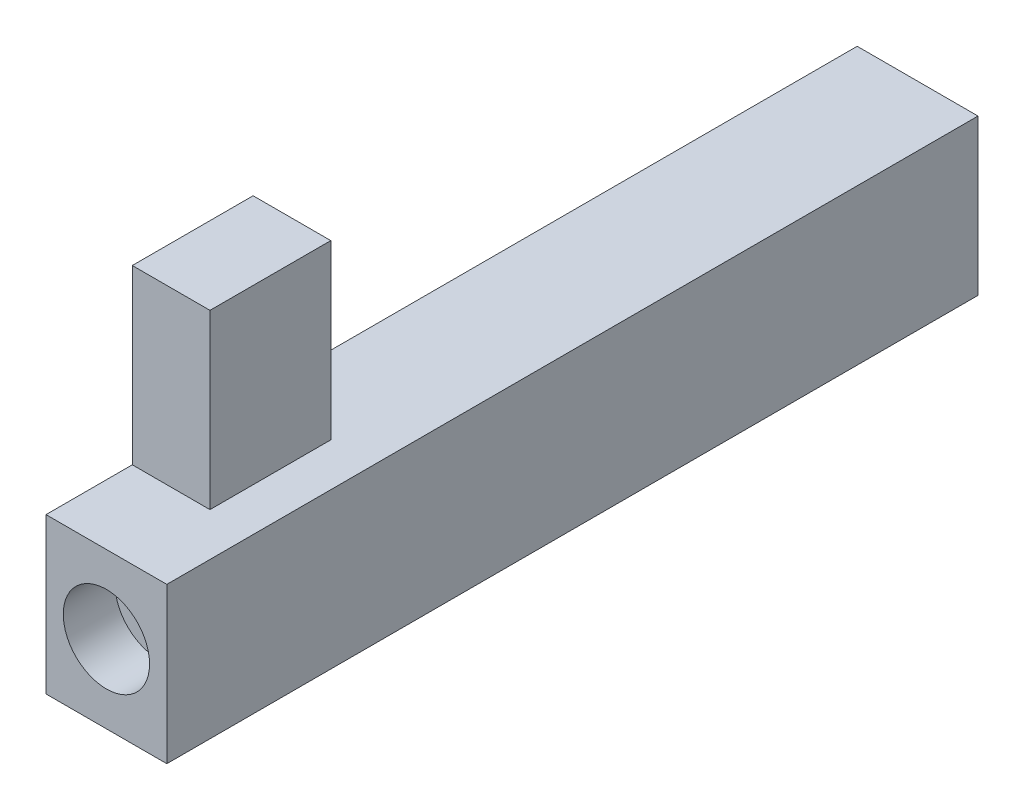
from build123d import *

# Parameters (mm, degrees)
CROQUIS1_W              = 7
CROQUIS1_H              = 47
SALIENTE_EXTRUIR1_DEPTH = 9
CROQUIS2_W              = 4.5
CROQUIS2_H              = 7
SALIENTE_EXTRUIR2_DEPTH = 10
CROQUIS3_R              = 1.25
CORTAR_EXTRUIR1_DEPTH   = 49
CROQUIS6_R              = 2.5
CORTAR_EXTRUIR2_DEPTH   = 3


with BuildPart() as part:
    # Croquis1 → Saliente-Extruir1 (new body)
    with BuildSketch(Plane(origin=(0, 0, 0), x_dir=(1, 0, 0), z_dir=(0, 1, 0))):
        with Locations((3.5, 23.5)):
            Rectangle(CROQUIS1_W, CROQUIS1_H)
    extrude(amount=SALIENTE_EXTRUIR1_DEPTH)

    # Croquis2 → Saliente-Extruir2 (add)
    with BuildSketch(Plane(origin=(0, 9, 0), x_dir=(1, 0, 0), z_dir=(0, 1, 0))):
        with Locations((2.25, 8.5)):
            Rectangle(CROQUIS2_W, CROQUIS2_H)
    extrude(amount=SALIENTE_EXTRUIR2_DEPTH)

    # Croquis3 → Cortar-Extruir1 (cut)
    with BuildSketch(Plane.XY):
        with Locations((3.5, 4.5)):
            Circle(CROQUIS3_R)
    extrude(amount=-CORTAR_EXTRUIR1_DEPTH, mode=Mode.SUBTRACT)

    # Croquis6 → Cortar-Extruir2 (cut)
    with BuildSketch(Plane.XY):
        with Locations((3.5, 4.5)):
            Circle(CROQUIS6_R)
    extrude(amount=-CORTAR_EXTRUIR2_DEPTH, mode=Mode.SUBTRACT)


solid = part.part
